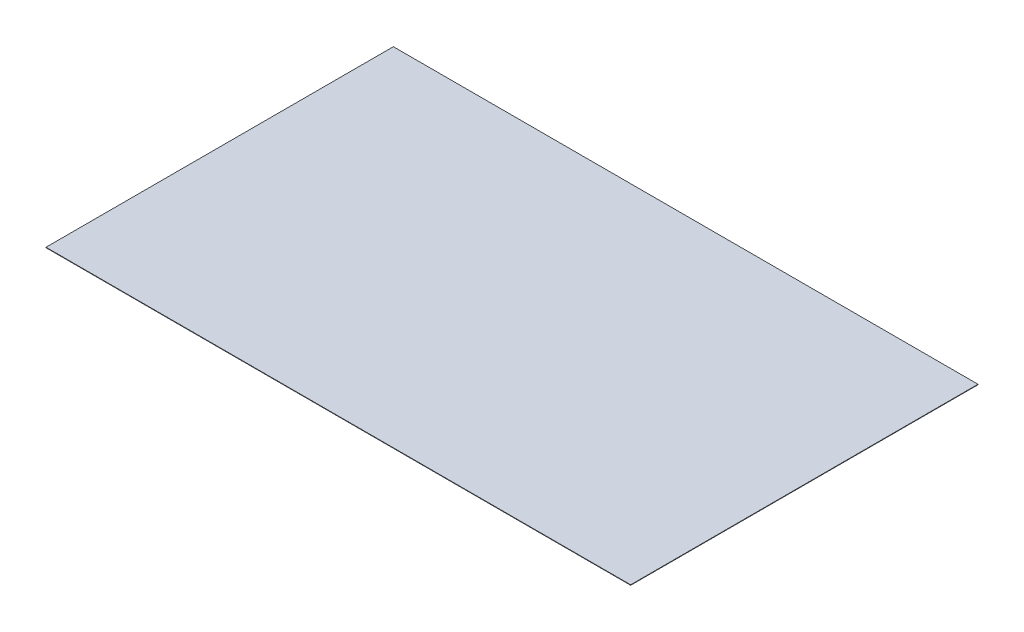
from build123d import *

# Parameters (mm, degrees)
SKETCH1_W            = 1275
SKETCH1_H            = 1
STORE_IC_ALT_1_DEPTH = 757.5


with BuildPart() as part:
    # Sketch1 → STORE_ic_alt_1 (new body)
    with BuildSketch(Plane.XY):
        with Locations((700, 182)):
            Rectangle(SKETCH1_W, SKETCH1_H)
    extrude(amount=-STORE_IC_ALT_1_DEPTH)


solid = part.part
